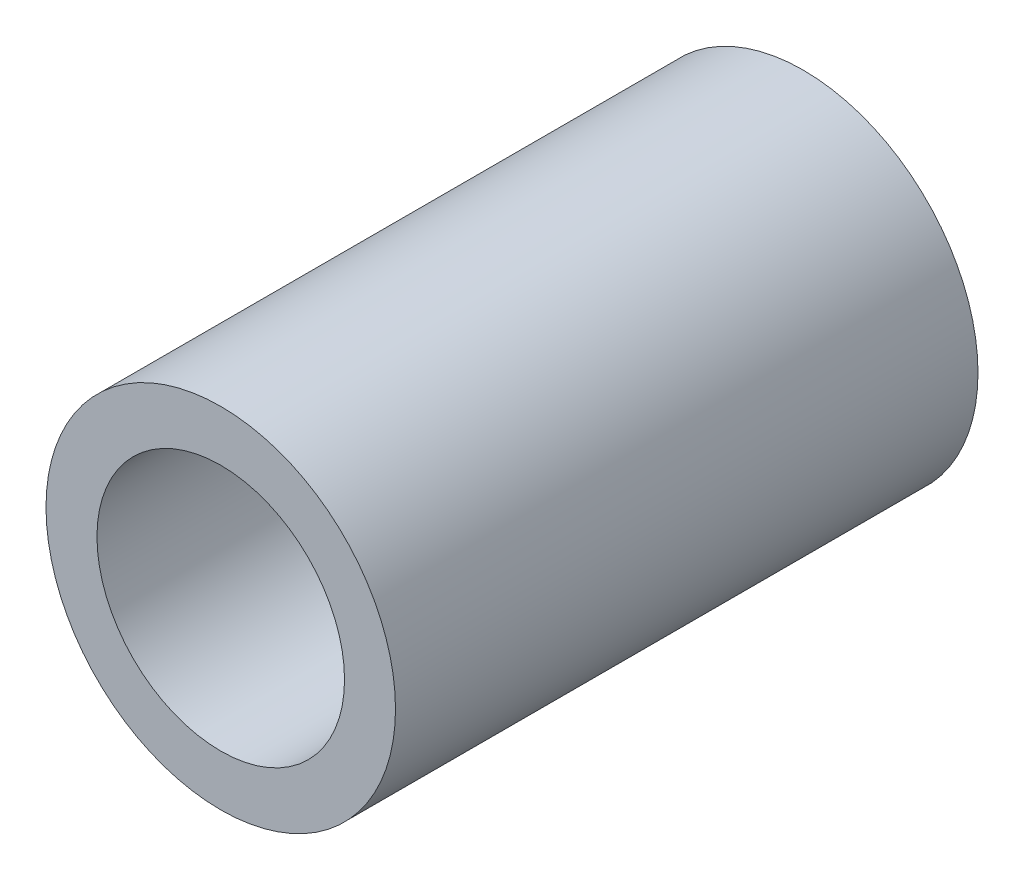
from build123d import *

# Parameters (mm, degrees)
SKETCH1_R           = 6
SKETCH1_R_2         = 4.25
BOSS_EXTRUDE1_DEPTH = 20


with BuildPart() as part:
    # Sketch1 → Boss-Extrude1 (new body)
    with BuildSketch(Plane.XY):
        with Locations((33, 0)):
            Circle(SKETCH1_R)
        with Locations((33, 0)):
            Circle(SKETCH1_R_2, mode=Mode.SUBTRACT)
    extrude(amount=BOSS_EXTRUDE1_DEPTH)


solid = part.part
